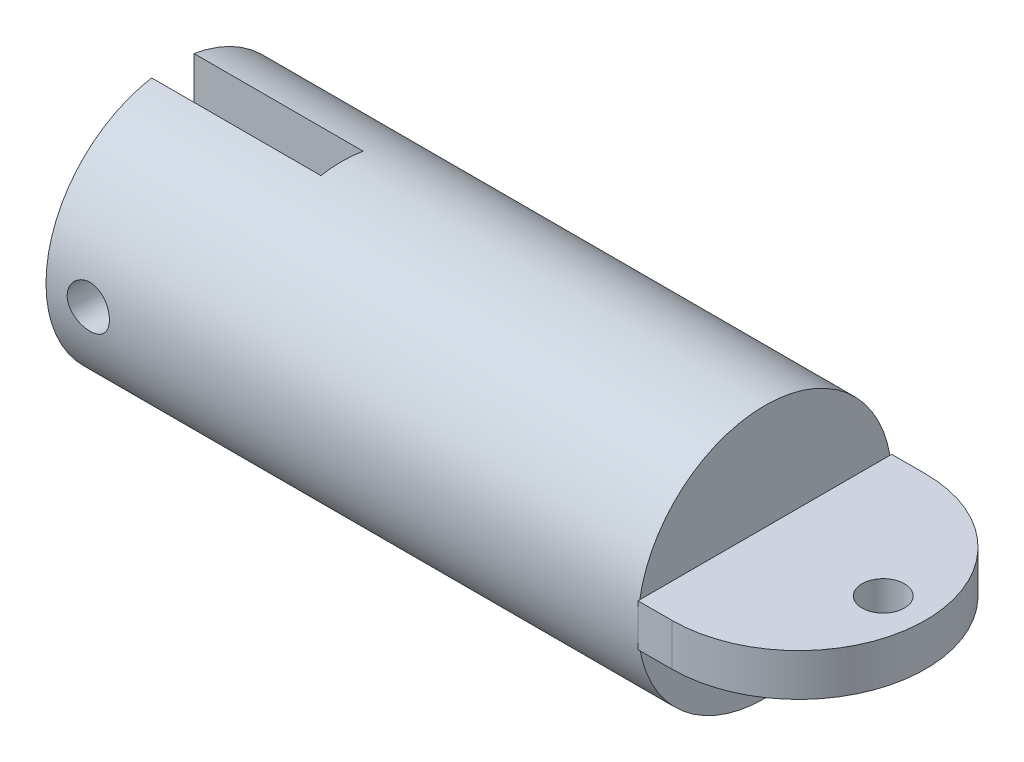
from build123d import *

# Parameters (mm, degrees)
SKETCH2_R               = 15
BOSS_EXTRUDE1_DEPTH     = 70
CUT_EXTRUDE1_DEPTH      = 74.143694192
CUT_EXTRUDE1_DEPTH_BACK = 74.143694192
SKETCH3_W               = 20
SKETCH3_H               = 5
CUT_EXTRUDE2_DEPTH      = 74.143694192
CUT_EXTRUDE2_DEPTH_BACK = 74.143694192
SKETCH6_R               = 2.5
SKETCH7_W               = 5
SKETCH7_H               = 30
BOSS_EXTRUDE2_DEPTH     = 4
BOSS_EXTRUDE3_DEPTH     = 5
CUT_EXTRUDE3_DEPTH      = 74.697015004
CUT_EXTRUDE3_DEPTH_BACK = 74.697015004
SKETCH9_R               = 2.5


with BuildPart() as part:
    # Sketch2 → Boss-Extrude1 (new body)
    with BuildSketch(Plane(origin=(0, 0, 0), x_dir=(0, 0, -1), z_dir=(1, 0, 0))):
        Circle(SKETCH2_R)
    extrude(amount=-BOSS_EXTRUDE1_DEPTH)

    # Sketch3 → Cut-Extrude1 (cut, two sides: drawn at the far end of the back side and taken through both)
    with BuildSketch(Plane(origin=(0, 0, 0), x_dir=(1, 0, 0), z_dir=(0, 1, 0)).offset(-CUT_EXTRUDE1_DEPTH_BACK)):
        with Locations((-60, 0)):
            Rectangle(SKETCH3_W, SKETCH3_H)
    extrude(amount=CUT_EXTRUDE1_DEPTH + CUT_EXTRUDE1_DEPTH_BACK, mode=Mode.SUBTRACT)

    # Sketch6 → Cut-Extrude2 (cut, two sides: drawn at the far end of the back side and taken through both)
    with BuildSketch(Plane.XY.offset(-CUT_EXTRUDE2_DEPTH_BACK)):
        with Locations((-65, 0)):
            Circle(SKETCH6_R)
    extrude(amount=CUT_EXTRUDE2_DEPTH + CUT_EXTRUDE2_DEPTH_BACK, mode=Mode.SUBTRACT)

    # Sketch7 → Boss-Extrude2 (add)
    with BuildSketch(Plane.YZ):
        Rectangle(SKETCH7_W, SKETCH7_H)
    extrude(amount=BOSS_EXTRUDE2_DEPTH)

    # Sketch8 → Boss-Extrude3 (add)
    with BuildSketch(Plane.XZ.offset(2.5)):
        with BuildLine():
            Line((4, 15), (4, -15))
            ThreePointArc((4, -15), (19, 0), (4, 15))
        make_face()
    extrude(amount=-BOSS_EXTRUDE3_DEPTH)

    # Sketch9 → Cut-Extrude3 (cut, two sides: drawn at the far end of the back side and taken through both)
    with BuildSketch(Plane.XZ.offset(2.5).offset(-CUT_EXTRUDE3_DEPTH_BACK)):
        with Locations(Location((14, 0, 0), (0, 0, 270))):
            Circle(SKETCH9_R)
    extrude(amount=CUT_EXTRUDE3_DEPTH + CUT_EXTRUDE3_DEPTH_BACK, mode=Mode.SUBTRACT)


solid = part.part
